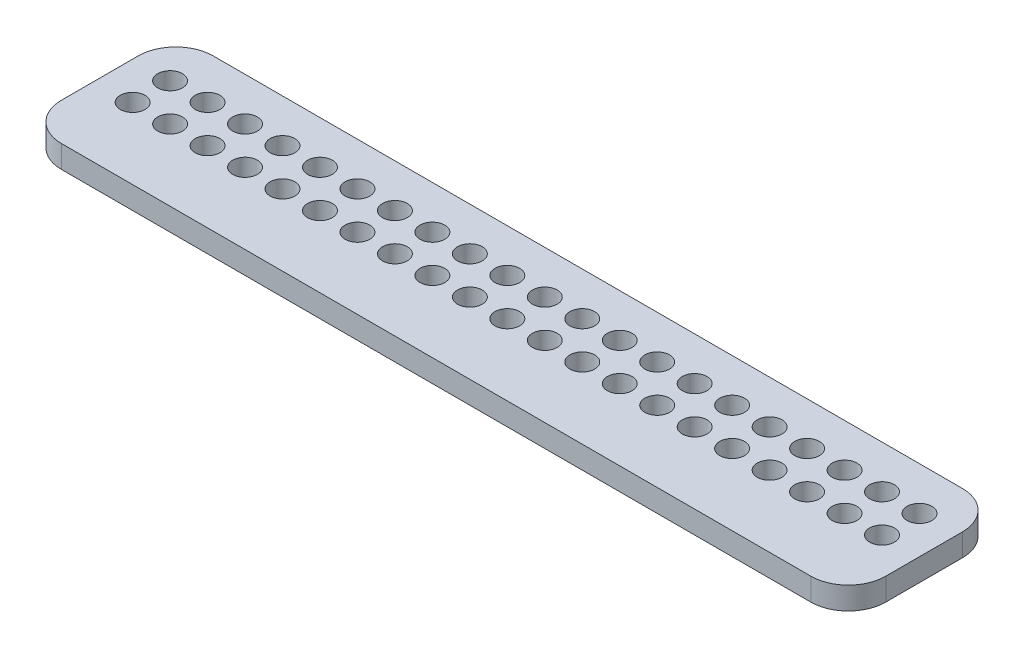
from build123d import *

# Parameters (mm, degrees)
SKETCH1_R           = 1.65
BOSS_EXTRUDE1_DEPTH = 3


with BuildPart() as part:
    # Sketch1 → Boss-Extrude1 (new body)
    with BuildSketch(Plane(origin=(0, 0, 0), x_dir=(1, 0, 0), z_dir=(0, 1, 0))):
        with BuildLine():
            Line((-57.431827558, 14.388379565), (42.568172442, 14.388379565))
            ThreePointArc((42.568172442, 14.388379565), (46.103706348, 15.852845659), (47.568172442, 19.388379565))
            Line((47.568172442, 19.388379565), (47.568172442, 29.638379565))
            ThreePointArc((47.568172442, 29.638379565), (46.103706348, 33.173913471), (42.568172442, 34.638379565))
            Line((42.568172442, 34.638379565), (-57.431827558, 34.638379565))
            ThreePointArc((-57.431827558, 34.638379565), (-60.967361464, 33.173913471), (-62.431827558, 29.638379565))
            Line((-62.431827558, 29.638379565), (-62.431827558, 19.388379565))
            ThreePointArc((-62.431827558, 19.388379565), (-60.967361464, 15.852845659), (-57.431827558, 14.388379565))
        make_face()
        with Locations(Location((-57.431827558, 28.888379565, 0), (0, 0, 270))):
            Circle(SKETCH1_R, mode=Mode.SUBTRACT)
        with Locations(Location((-52.431827558, 28.888379565, 0), (0, 0, 270))):
            Circle(SKETCH1_R, mode=Mode.SUBTRACT)
        with Locations(Location((-47.431827558, 28.888379565, 0), (0, 0, 270))):
            Circle(SKETCH1_R, mode=Mode.SUBTRACT)
        with Locations(Location((-42.431827558, 28.888379565, 0), (0, 0, 270))):
            Circle(SKETCH1_R, mode=Mode.SUBTRACT)
        with Locations(Location((-37.431827558, 28.888379565, 0), (0, 0, 270))):
            Circle(SKETCH1_R, mode=Mode.SUBTRACT)
        with Locations(Location((-32.431827558, 28.888379565, 0), (0, 0, 270))):
            Circle(SKETCH1_R, mode=Mode.SUBTRACT)
        with Locations(Location((-27.431827558, 28.888379565, 0), (0, 0, 270))):
            Circle(SKETCH1_R, mode=Mode.SUBTRACT)
        with Locations(Location((-22.431827558, 28.888379565, 0), (0, 0, 270))):
            Circle(SKETCH1_R, mode=Mode.SUBTRACT)
        with Locations(Location((-17.431827558, 28.888379565, 0), (0, 0, 270))):
            Circle(SKETCH1_R, mode=Mode.SUBTRACT)
        with Locations(Location((-12.431827558, 28.888379565, 0), (0, 0, 270))):
            Circle(SKETCH1_R, mode=Mode.SUBTRACT)
        with Locations(Location((-7.431827558, 28.888379565, 0), (0, 0, 270))):
            Circle(SKETCH1_R, mode=Mode.SUBTRACT)
        with Locations(Location((-2.431827558, 28.888379565, 0), (0, 0, 270))):
            Circle(SKETCH1_R, mode=Mode.SUBTRACT)
        with Locations(Location((2.568172442, 28.888379565, 0), (0, 0, 270))):
            Circle(SKETCH1_R, mode=Mode.SUBTRACT)
        with Locations(Location((7.568172442, 28.888379565, 0), (0, 0, 270))):
            Circle(SKETCH1_R, mode=Mode.SUBTRACT)
        with Locations(Location((12.568172442, 28.888379565, 0), (0, 0, 270))):
            Circle(SKETCH1_R, mode=Mode.SUBTRACT)
        with Locations(Location((17.568172442, 28.888379565, 0), (0, 0, 270))):
            Circle(SKETCH1_R, mode=Mode.SUBTRACT)
        with Locations(Location((22.568172442, 28.888379565, 0), (0, 0, 270))):
            Circle(SKETCH1_R, mode=Mode.SUBTRACT)
        with Locations(Location((27.568172442, 28.888379565, 0), (0, 0, 270))):
            Circle(SKETCH1_R, mode=Mode.SUBTRACT)
        with Locations(Location((32.568172442, 28.888379565, 0), (0, 0, 270))):
            Circle(SKETCH1_R, mode=Mode.SUBTRACT)
        with Locations(Location((37.568172442, 28.888379565, 0), (0, 0, 270))):
            Circle(SKETCH1_R, mode=Mode.SUBTRACT)
        with Locations(Location((42.568172442, 28.888379565, 0), (0, 0, 270))):
            Circle(SKETCH1_R, mode=Mode.SUBTRACT)
        with Locations(Location((-52.431827558, 23.888379565, 0), (0, 0, 270))):
            Circle(SKETCH1_R, mode=Mode.SUBTRACT)
        with Locations(Location((-47.431827558, 23.888379565, 0), (0, 0, 270))):
            Circle(SKETCH1_R, mode=Mode.SUBTRACT)
        with Locations(Location((-42.431827558, 23.888379565, 0), (0, 0, 270))):
            Circle(SKETCH1_R, mode=Mode.SUBTRACT)
        with Locations(Location((-37.431827558, 23.888379565, 0), (0, 0, 270))):
            Circle(SKETCH1_R, mode=Mode.SUBTRACT)
        with Locations(Location((-32.431827558, 23.888379565, 0), (0, 0, 270))):
            Circle(SKETCH1_R, mode=Mode.SUBTRACT)
        with Locations(Location((-27.431827558, 23.888379565, 0), (0, 0, 270))):
            Circle(SKETCH1_R, mode=Mode.SUBTRACT)
        with Locations(Location((-22.431827558, 23.888379565, 0), (0, 0, 270))):
            Circle(SKETCH1_R, mode=Mode.SUBTRACT)
        with Locations(Location((-17.431827558, 23.888379565, 0), (0, 0, 270))):
            Circle(SKETCH1_R, mode=Mode.SUBTRACT)
        with Locations(Location((-12.431827558, 23.888379565, 0), (0, 0, 270))):
            Circle(SKETCH1_R, mode=Mode.SUBTRACT)
        with Locations(Location((-7.431827558, 23.888379565, 0), (0, 0, 270))):
            Circle(SKETCH1_R, mode=Mode.SUBTRACT)
        with Locations(Location((-2.431827558, 23.888379565, 0), (0, 0, 270))):
            Circle(SKETCH1_R, mode=Mode.SUBTRACT)
        with Locations(Location((2.568172442, 23.888379565, 0), (0, 0, 270))):
            Circle(SKETCH1_R, mode=Mode.SUBTRACT)
        with Locations(Location((7.568172442, 23.888379565, 0), (0, 0, 270))):
            Circle(SKETCH1_R, mode=Mode.SUBTRACT)
        with Locations(Location((12.568172442, 23.888379565, 0), (0, 0, 270))):
            Circle(SKETCH1_R, mode=Mode.SUBTRACT)
        with Locations(Location((17.568172442, 23.888379565, 0), (0, 0, 270))):
            Circle(SKETCH1_R, mode=Mode.SUBTRACT)
        with Locations(Location((22.568172442, 23.888379565, 0), (0, 0, 270))):
            Circle(SKETCH1_R, mode=Mode.SUBTRACT)
        with Locations(Location((27.568172442, 23.888379565, 0), (0, 0, 270))):
            Circle(SKETCH1_R, mode=Mode.SUBTRACT)
        with Locations(Location((32.568172442, 23.888379565, 0), (0, 0, 270))):
            Circle(SKETCH1_R, mode=Mode.SUBTRACT)
        with Locations(Location((37.568172442, 23.888379565, 0), (0, 0, 270))):
            Circle(SKETCH1_R, mode=Mode.SUBTRACT)
        with Locations(Location((42.568172442, 23.888379565, 0), (0, 0, 270))):
            Circle(SKETCH1_R, mode=Mode.SUBTRACT)
        with Locations(Location((-57.431827558, 23.888379565, 0), (0, 0, 270))):
            Circle(SKETCH1_R, mode=Mode.SUBTRACT)
    extrude(amount=BOSS_EXTRUDE1_DEPTH)


solid = part.part
